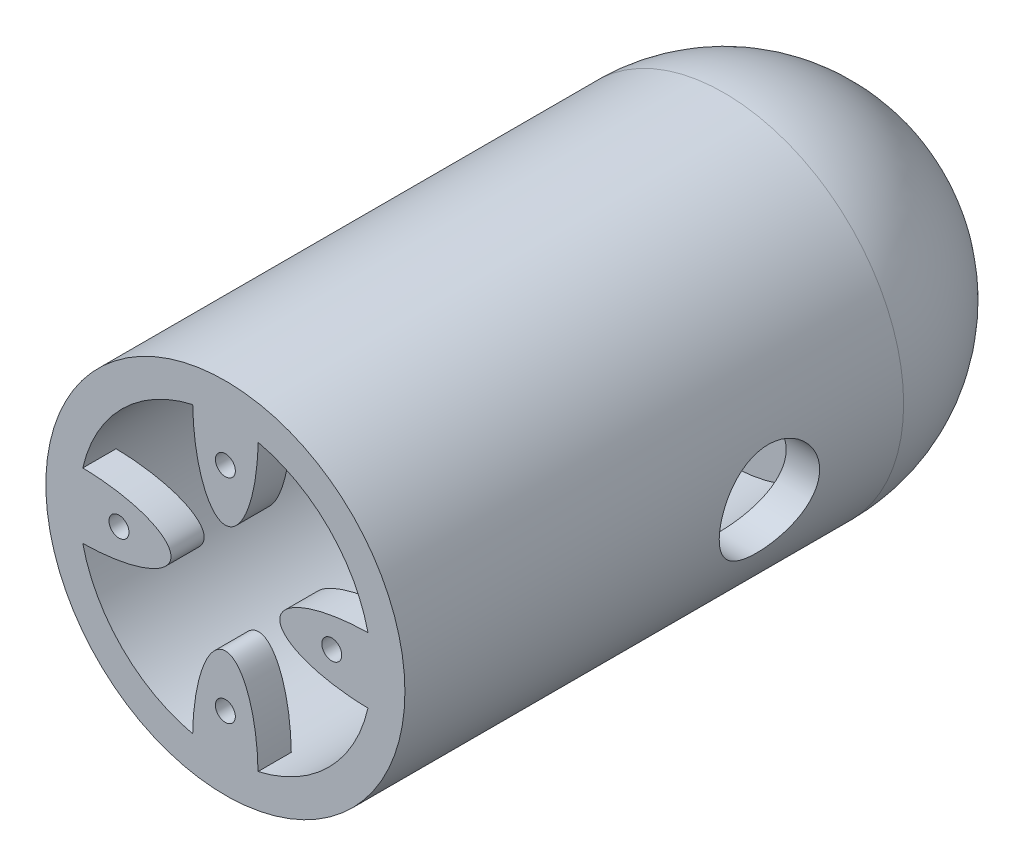
from build123d import *

# Parameters (mm, degrees)
SKETCH1_R               = 27
BOSS_EXTRUDE1_DEPTH     = 37.5
CUT_EXTRUDE2_DEPTH      = 54.518688325
CUT_EXTRUDE2_DEPTH_BACK = 54.518688325
SKETCH3_R               = 7.5
REVOLVE1_ANGLE          = 180
SKETCH2_R               = 22
CUT_EXTRUDE3_DEPTH      = 76
SKETCH13_R              = 1.5
BOSS_EXTRUDE3_DEPTH     = 5
CIRPATTERN1_COUNT       = 4


with BuildPart() as part:
    # Sketch1 → Boss-Extrude1 (new, symmetric)
    with BuildSketch(Plane.XY):
        Circle(SKETCH1_R)
    extrude(amount=BOSS_EXTRUDE1_DEPTH, both=True)

    # Sketch3 → Cut-Extrude2 (cut, two sides: drawn at the far end of the back side and taken through both)
    with BuildSketch(Plane(origin=(0, 0, 0), x_dir=(0, 0, -1), z_dir=(1, 0, 0)).offset(-CUT_EXTRUDE2_DEPTH_BACK)):
        with Locations((17.5, -3)):
            Circle(SKETCH3_R)
    extrude(amount=CUT_EXTRUDE2_DEPTH + CUT_EXTRUDE2_DEPTH_BACK, mode=Mode.SUBTRACT)

    # Sketch7 → Revolve1 (revolve)
    with BuildSketch(Plane(origin=(0, 0, -37.5), x_dir=(-1, 0, 0), z_dir=(0, 0, -1))):
        with BuildLine():
            Line((0, 27), (0, -27))
            ThreePointArc((0, -27), (-27, 0), (0, 27))
        make_face()
    revolve(axis=Axis((0, 27, -37.5), (0, 1, 0)), revolution_arc=REVOLVE1_ANGLE)

    # Sketch2 → Cut-Extrude3 (cut)
    with BuildSketch(Plane.XY.offset(37.5)):
        Circle(SKETCH2_R)
    extrude(amount=-CUT_EXTRUDE3_DEPTH, mode=Mode.SUBTRACT)

    # Sketch13 → Boss-Extrude3 (add)
    with BuildSketch(Plane.XY.offset(37.5)):
        with BuildLine():
            ThreePointArc((-21.444531116, 4.912441881), (-22, 0), (-21.444531116, -4.912441881))
            add(Edge.make_bspline(
                [(-21.444531116, -4.912441881), (-8.186572838, -4.722538036), (-8.186572838, 0), (-8.186572838, 4.722538036), (-21.444531116, 4.912441881)],
                knots=[1.611019415, 1.611019415, 1.611019415, 3.141592654, 3.141592654, 4.672165893, 4.672165893, 4.672165893], degree=2, weights=[1, 0.721183833, 1, 0.721183833, 1]))
        make_face()
        with Locations((-16, 0)):
            Circle(SKETCH13_R, mode=Mode.SUBTRACT)
    boss_extrude3 = extrude(amount=-BOSS_EXTRUDE3_DEPTH)

    # CirPattern1: Boss-Extrude3 ×4 about axis
    cirpattern1_axis = Axis((0, 0, 37.5), (0, 0, -1))
    for i in range(1, CIRPATTERN1_COUNT):
        add(boss_extrude3.rotate(cirpattern1_axis, i * 360 / CIRPATTERN1_COUNT))


solid = part.part
